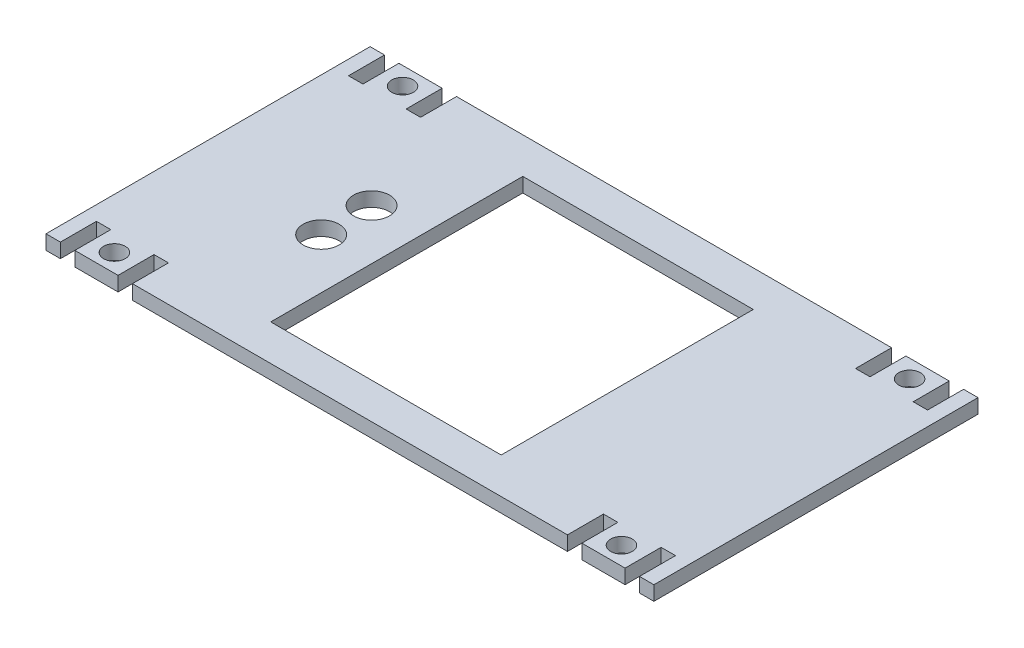
from build123d import *

# Parameters (mm, degrees)
SKETCH1_R           = 1.5
BOSS_EXTRUDE1_DEPTH = 2
SKETCH2_W           = 32
SKETCH2_H           = 35
CUT_EXTRUDE1_DEPTH  = 10
SKETCH3_R           = 2.5
CUT_EXTRUDE2_DEPTH  = 10


with BuildPart() as part:
    # Sketch1 → Boss-Extrude1 (new body)
    with BuildSketch(Plane(origin=(0, 0, 0), x_dir=(1, 0, 0), z_dir=(0, 1, 0))):
        Polygon((0, 0), (2, 0), (2, 5), (4, 5), (4, 0), (10, 0), (10, 5), (12, 5), (12, 0), (72.4, 0), (72.4, 5), (74.4, 5), (74.4, 0), (80.4, 0), (80.4, 5), (82.4, 5), (82.4, 0), (84.4, 0), (84.4, 45), (82.4, 45), (82.4, 40), (80.4, 40), (80.4, 45), (74.4, 45), (74.4, 40), (72.4, 40), (72.4, 45), (12, 45), (12, 40), (10, 40), (10, 45), (4, 45), (4, 40), (2, 40), (2, 45), (0, 45), align=None)
        with Locations(Location((7, 42.5, 0), (0, 0, 270))):
            Circle(SKETCH1_R, mode=Mode.SUBTRACT)
        with Locations(Location((77.4, 42.5, 0), (0, 0, 90))):
            Circle(SKETCH1_R, mode=Mode.SUBTRACT)
        with Locations(Location((7, 2.5, 0), (0, 0, 90))):
            Circle(SKETCH1_R, mode=Mode.SUBTRACT)
        with Locations(Location((77.4, 2.5, 0), (0, 0, 270))):
            Circle(SKETCH1_R, mode=Mode.SUBTRACT)
    extrude(amount=BOSS_EXTRUDE1_DEPTH)

    # Sketch2 → Cut-Extrude1 (cut)
    with BuildSketch(Plane(origin=(0, 2, 0), x_dir=(1, 0, 0), z_dir=(0, 1, 0))):
        with Locations((42.2, 22.5)):
            Rectangle(SKETCH2_W, SKETCH2_H)
    extrude(amount=-CUT_EXTRUDE1_DEPTH, mode=Mode.SUBTRACT)

    # Sketch3 → Cut-Extrude2 (cut)
    with BuildSketch(Plane(origin=(0, 2, 0), x_dir=(1, 0, 0), z_dir=(0, 1, 0))):
        with Locations(Location((19.2, 26, 0), (0, 0, 270))):
            Circle(SKETCH3_R)
        with Locations(Location((19.2, 19, 0), (0, 0, 90))):
            Circle(SKETCH3_R)
    extrude(amount=-CUT_EXTRUDE2_DEPTH, mode=Mode.SUBTRACT)


solid = part.part
